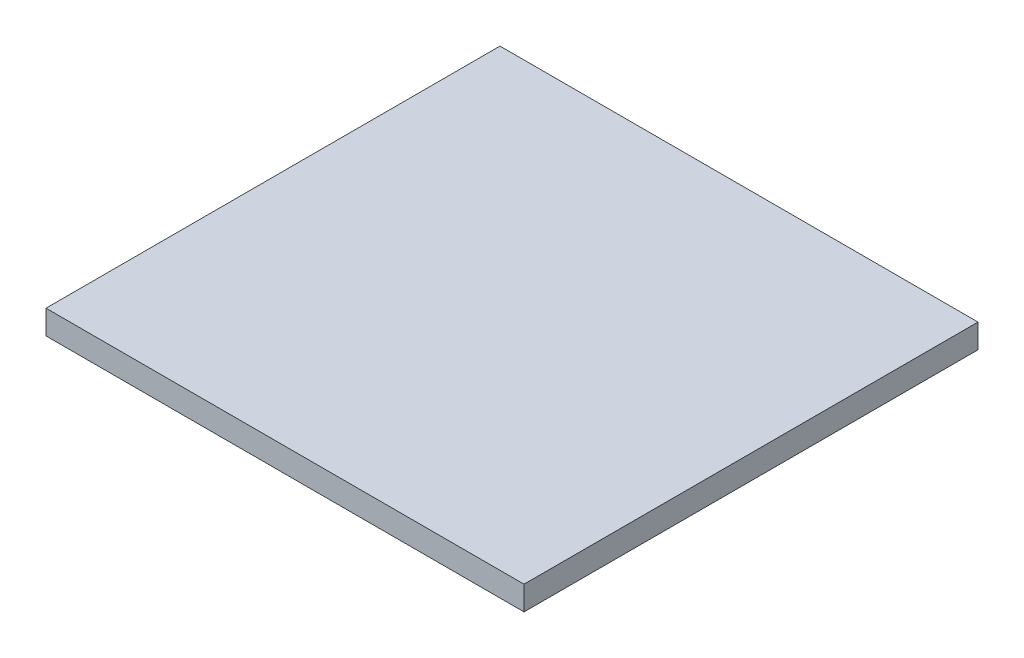
from build123d import *

# Parameters (mm, degrees)
CROQUIS1_W              = 358
CROQUIS1_H              = 340
SALIENTE_EXTRUIR1_DEPTH = 18


with BuildPart() as part:
    # Croquis1 → Saliente-Extruir1 (new body)
    with BuildSketch(Plane(origin=(0, 0, 0), x_dir=(1, 0, 0), z_dir=(0, 1, 0))):
        Rectangle(CROQUIS1_W, CROQUIS1_H)
    extrude(amount=SALIENTE_EXTRUIR1_DEPTH)


solid = part.part
